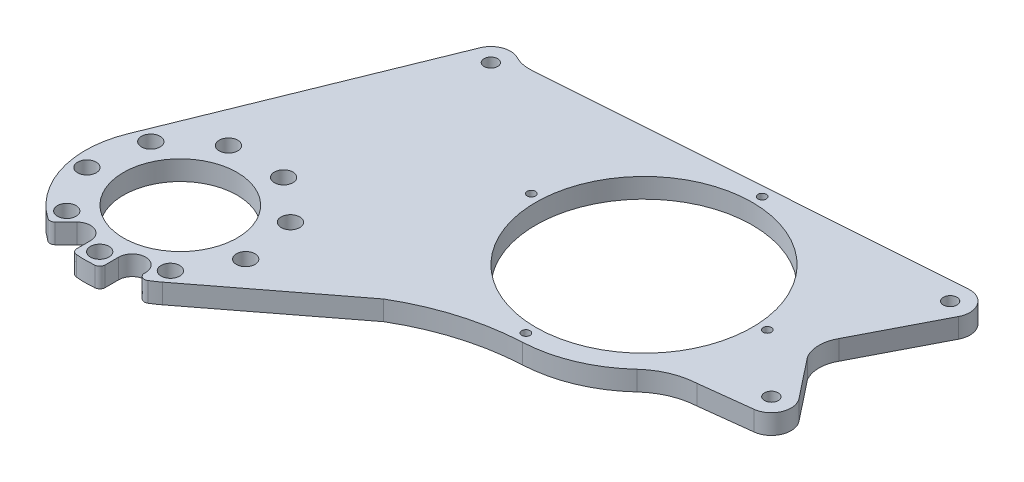
from build123d import *

# Parameters (mm, degrees)
SKETCH1_R                      = 27.4955
SKETCH1_R_2                    = 2
SKETCH1_R_3                    = 52.3875
SKETCH1_R_4                    = 3.3
BOSS_EXTRUDE1_DEPTH            = 9.525
M8_CLEARANCE_HOLE1_D           = 9
M8_CLEARANCE_HOLE1_CSINK_D     = 9.05
M8_CLEARANCE_HOLE1_CSINK_ANGLE = 90
CIRPATTERN1_COUNT              = 9


with BuildPart() as part:
    # Sketch1 → Boss-Extrude1 (new body)
    with BuildSketch(Plane(origin=(0, 0, 0), x_dir=(-1, 0, 0), z_dir=(0, 1, 0))):
        with BuildLine():
            Line((-663.918846707, 4.476573271), (-466.57213203, 18.457038772))
            ThreePointArc((-466.57213203, 18.457038772), (-462.140898161, 18.198594818), (-457.960546806, 16.706184206))
            ThreePointArc((-457.960546806, 16.706184206), (-450.250504554, 16.184701691), (-444.691176426, 21.552249203))
            Line((-444.691176426, 21.552249203), (-395.545795992, 142.743123059))
            ThreePointArc((-395.545795992, 142.743123059), (-394.045633102, 172.997422567), (-411.692336104, 197.617881552))
            ThreePointArc((-411.692336104, 197.617881552), (-413.372500119, 198.071242365), (-414.950136715, 197.336701751))
            Line((-414.950136715, 197.336701751), (-420.215020333, 192.071818133))
            ThreePointArc((-420.215020333, 192.071818133), (-427.298656721, 190.662795249), (-431.31121441, 196.668012211))
            Line((-431.31121441, 196.668012211), (-431.31121441, 203.240745001))
            ThreePointArc((-431.31121441, 203.240745001), (-431.968379704, 204.945600851), (-433.59982344, 205.768273949))
            ThreePointArc((-433.59982344, 205.768273949), (-438.15, 205.994), (-442.70017656, 205.768273949))
            ThreePointArc((-442.70017656, 205.768273949), (-444.331620296, 204.945600851), (-444.98878559, 203.240745001))
            Line((-444.98878559, 203.240745001), (-444.98878559, 196.668012211))
            ThreePointArc((-444.98878559, 196.668012211), (-451.48878559, 190.168012211), (-457.98878559, 196.668012211))
            Line((-457.98878559, 196.668012211), (-457.98878559, 197.245022653))
            ThreePointArc((-457.98878559, 197.245022653), (-459.278285753, 199.455870942), (-461.837486501, 199.421924563))
            ThreePointArc((-461.837486501, 199.421924563), (-464.019895008, 198.024699819), (-466.120112298, 196.506730383))
            Line((-466.120112298, 196.506730383), (-526.629683433, 150.121113421))
            ThreePointArc((-526.629683433, 150.121113421), (-551.530592574, 139.247052869), (-578.312485484, 134.661130809))
            ThreePointArc((-578.312485484, 134.661130809), (-599.244289514, 129.920579306), (-617.300018038, 118.318686532))
            ThreePointArc((-617.300018038, 118.318686532), (-626.772573796, 112.207783301), (-637.753125569, 109.658286556))
            Line((-637.753125569, 109.658286556), (-662.485690794, 106.73386739))
            ThreePointArc((-662.485690794, 106.73386739), (-670.168377129, 100.916938085), (-668.842832121, 91.372134981))
            Line((-668.842832121, 91.372134981), (-653.346537148, 71.746276485))
            ThreePointArc((-653.346537148, 71.746276485), (-651.347572908, 64.158994024), (-653.346537148, 56.571711562))
            Line((-653.346537148, 56.571711562), (-673.057822329, 18.34288652))
            ThreePointArc((-673.057822329, 18.34288652), (-672.544957076, 8.73610108), (-663.918846707, 4.476573271))
        make_face()
        with Locations(Location((-438.15, 160.02, 0), (0, 0, 270))):
            Circle(SKETCH1_R, mode=Mode.SUBTRACT)
        with Locations(Location((-632.402453753, 70.257452317, 0), (0, 0, 270))):
            Circle(SKETCH1_R_2, mode=Mode.SUBTRACT)
        with Locations(Location((-575.31, 72.821477372, 0), (0, 0, 270))):
            Circle(SKETCH1_R_3, mode=Mode.SUBTRACT)
        with Locations(Location((-661.367230642, 97.274762153, 0), (0, 0, 270))):
            Circle(SKETCH1_R_4, mode=Mode.SUBTRACT)
        with Locations(Location((-664.591931322, 13.977761728, 0), (0, 0, 270))):
            Circle(SKETCH1_R_4, mode=Mode.SUBTRACT)
        with Locations(Location((-453.518014272, 25.131712658, 0), (0, 0, 270))):
            Circle(SKETCH1_R_4, mode=Mode.SUBTRACT)
        with BuildLine():
            ThreePointArc((-518.217546247, 72.257452317), (-520.217546247, 70.257452317), (-518.217546247, 68.257452317))
            ThreePointArc((-518.217546247, 68.257452317), (-516.217546247, 70.257452317), (-518.217546247, 72.257452317))
        make_face(mode=Mode.SUBTRACT)
        with BuildLine():
            ThreePointArc((-575.31, 17.671477372), (-577.31, 15.671477372), (-575.31, 13.671477372))
            ThreePointArc((-575.31, 13.671477372), (-573.31, 15.671477372), (-575.31, 17.671477372))
        make_face(mode=Mode.SUBTRACT)
        with BuildLine():
            ThreePointArc((-575.31, 131.971477372), (-577.31, 129.971477372), (-575.31, 127.971477372))
            ThreePointArc((-575.31, 127.971477372), (-573.31, 129.971477372), (-575.31, 131.971477372))
        make_face(mode=Mode.SUBTRACT)
    extrude(amount=BOSS_EXTRUDE1_DEPTH)

    # M8 Clearance Hole1 (through all)
    with Locations(Plane(origin=(0, 0, 0), x_dir=(-1, 0, 0), z_dir=(0, -1, 0))):
        with Locations((-438.15, -199.019999978)):
            m8_clearance_hole1 = CounterSinkHole(M8_CLEARANCE_HOLE1_D / 2, M8_CLEARANCE_HOLE1_CSINK_D / 2, counter_sink_angle=M8_CLEARANCE_HOLE1_CSINK_ANGLE)

    # CirPattern1: M8 Clearance Hole1 ×9 about axis
    cirpattern1_axis = Axis((438.15, 0, 160.02), (0, 1, 0))
    for i in range(1, CIRPATTERN1_COUNT):
        add(m8_clearance_hole1.rotate(cirpattern1_axis, i * 360 / CIRPATTERN1_COUNT), mode=Mode.SUBTRACT)


solid = part.part
